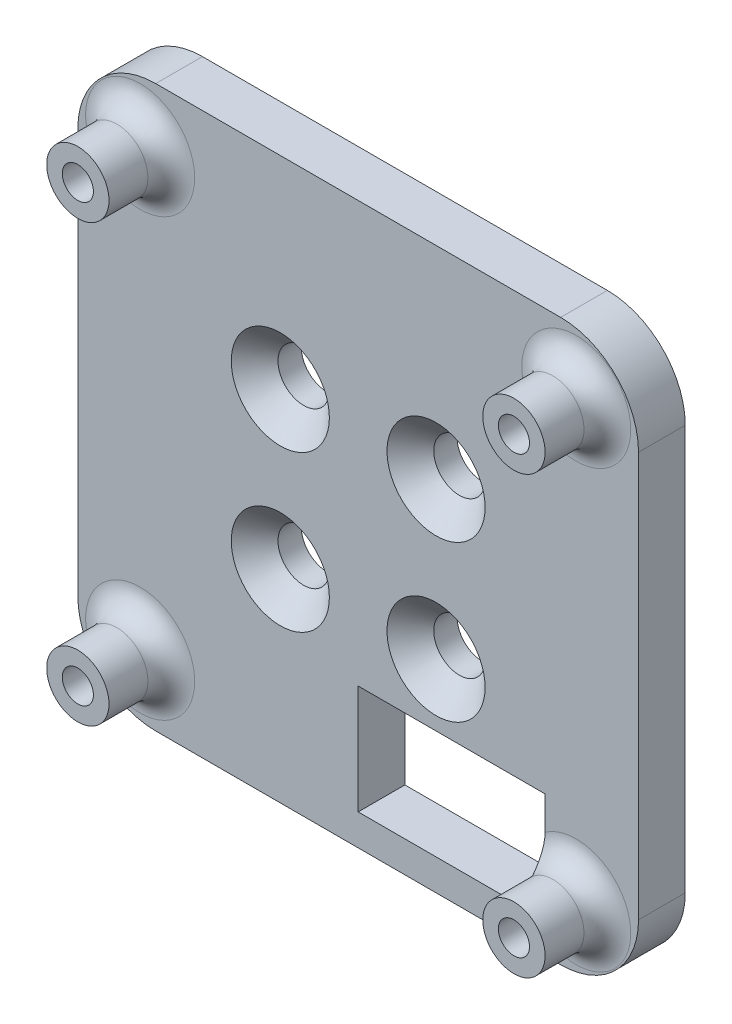
from build123d import *

# Parameters (mm, degrees)
SKETCH_1_W             = 36
SKETCH_1_H             = 36
SKETCH_1_R             = 1
SKETCH_1_R_2           = 1.65
EXTRUDE_1181_DEPTH     = 3
SKETCH_2_R             = 2
SKETCH_2_R_2           = 1
EXTRUDE_1649_DEPTH     = 4
FILLET_1_R             = 5
FILLET_3_R             = 1.5
CHAMFER_1_SIZE         = 1.5
CUT_EXTRUDE_2275_REACH = 28.401
SKETCH_1_3_W           = 12
SKETCH_1_3_H           = 7


with BuildPart() as part:
    # Эскиз1 → Extrude 1181 (new body)
    with BuildSketch(Plane.XY):
        Rectangle(SKETCH_1_W, SKETCH_1_H)
        with Locations((-14, -14)):
            Circle(SKETCH_1_R, mode=Mode.SUBTRACT)
        with Locations((-5, -5)):
            Circle(SKETCH_1_R_2, mode=Mode.SUBTRACT)
        with Locations((14, -14)):
            Circle(SKETCH_1_R, mode=Mode.SUBTRACT)
        with Locations((5, -5)):
            Circle(SKETCH_1_R_2, mode=Mode.SUBTRACT)
        with Locations((-5, 5)):
            Circle(SKETCH_1_R_2, mode=Mode.SUBTRACT)
        with Locations((-14, 14)):
            Circle(SKETCH_1_R, mode=Mode.SUBTRACT)
        with Locations((5, 5)):
            Circle(SKETCH_1_R_2, mode=Mode.SUBTRACT)
        with Locations((14, 14)):
            Circle(SKETCH_1_R, mode=Mode.SUBTRACT)
    extrude(amount=EXTRUDE_1181_DEPTH)

    # Эскиз2 → Extrude 1649 (add)
    # profile 1 of 4: a face of its own
    with BuildSketch(Plane.XY.offset(3)):
        with Locations((-14, 14)):
            Circle(SKETCH_2_R)
        with Locations((-14, 14)):
            Circle(SKETCH_2_R_2, mode=Mode.SUBTRACT)
    # profile 2 of 4: a face of its own
    with BuildSketch(Plane.XY.offset(3)):
        with Locations((14, 14)):
            Circle(SKETCH_2_R)
        with Locations((14, 14)):
            Circle(SKETCH_2_R_2, mode=Mode.SUBTRACT)
    # profile 3 of 4: a face of its own
    with BuildSketch(Plane.XY.offset(3)):
        with Locations((14, -14)):
            Circle(SKETCH_2_R)
        with Locations((14, -14)):
            Circle(SKETCH_2_R_2, mode=Mode.SUBTRACT)
    # profile 4 of 4: a face of its own
    with BuildSketch(Plane.XY.offset(3)):
        with Locations((-14, -14)):
            Circle(SKETCH_2_R)
        with Locations((-14, -14)):
            Circle(SKETCH_2_R_2, mode=Mode.SUBTRACT)
    extrude(amount=EXTRUDE_1649_DEPTH)

    # Скругление1
    fillet_1_edges = [part.edges().sort_by_distance(p)[0] for p in [
        (-18, -18, 1.5),
        (18, -18, 1.5),
        (18, 18, 1.5),
        (-18, 18, 1.5),
    ]]
    fillet(fillet_1_edges, radius=FILLET_1_R)

    # Скругление3
    fillet_3_edges = [part.edges().sort_by_distance(p)[0] for p in [
        (-16, -14, 3),
        (12, -14, 3),
        (12, 14, 3),
        (-16, 14, 3),
    ]]
    fillet(fillet_3_edges, radius=FILLET_3_R)

    # Фаска1
    chamfer_1_edges = [part.edges().sort_by_distance(p)[0] for p in [
        (-6.65, -5, 3),
        (3.35, -5, 3),
        (3.35, 5, 3),
        (-6.65, 5, 3),
    ]]
    chamfer(chamfer_1_edges, length=CHAMFER_1_SIZE)

    # Эскиз1<3> → Cut-Extrude 2275 (cut, up to next)
    with BuildSketch(Plane.XY, mode=Mode.PRIVATE) as cut_extrude_2275_sk1:
        with Locations((6, -12.5)):
            Rectangle(SKETCH_1_3_W, SKETCH_1_3_H)
    cut_extrude_2275_tool1 = extrude(cut_extrude_2275_sk1.sketch, amount=CUT_EXTRUDE_2275_REACH, mode=Mode.PRIVATE) & part.part
    add(cut_extrude_2275_tool1.solids().sort_by_distance((6, -12.5, 0))[0], mode=Mode.SUBTRACT)


solid = part.part
